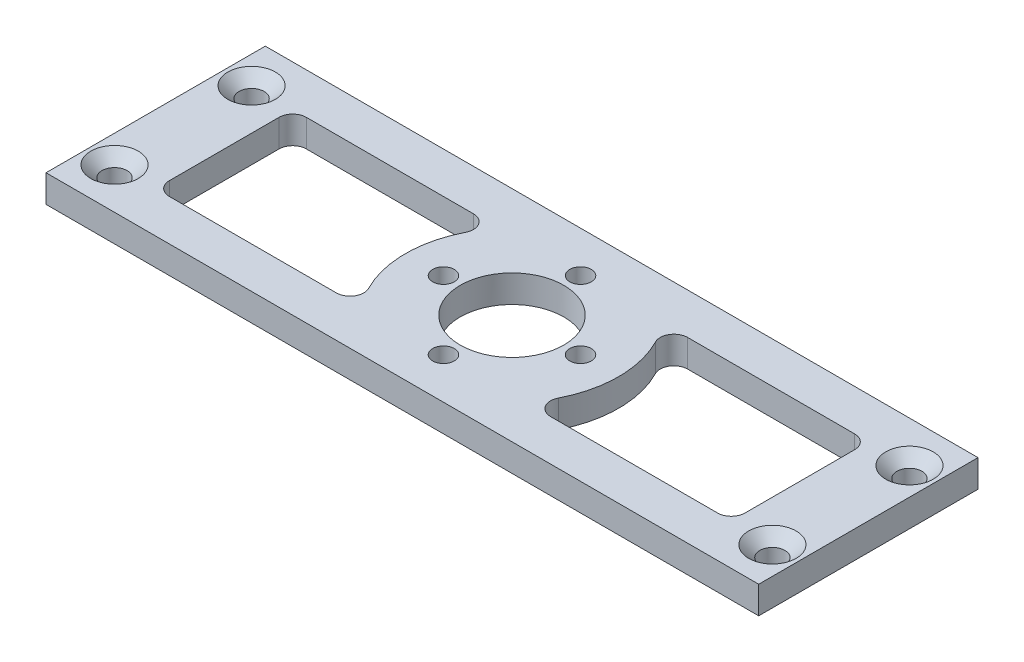
from build123d import *

# Parameters (mm, degrees)
SKETCH1_W                                         = 82.55
SKETCH1_H                                         = 25.4
BOSS_EXTRUDE1_DEPTH                               = 1.5875
F_12_0MM_DOWEL_HOLE1_D                            = 12
M3X0_5_TAPPED_HOLE1_D                             = 2.5
CSK_FOR_M2_5_FLAT_HEAD_MACHINE_SCREW1_D           = 2.9
CSK_FOR_M2_5_FLAT_HEAD_MACHINE_SCREW1_CSINK_D     = 5.5
CSK_FOR_M2_5_FLAT_HEAD_MACHINE_SCREW1_CSINK_ANGLE = 90
CUT_EXTRUDE1_DEPTH                                = 44.301226888
FILLET1_R                                         = 1.5875


with BuildPart() as part:
    # Sketch1 → Boss-Extrude1 (new, symmetric)
    with BuildSketch(Plane(origin=(0, 0, 0), x_dir=(1, 0, 0), z_dir=(0, 1, 0))):
        Rectangle(SKETCH1_W, SKETCH1_H)
    extrude(amount=BOSS_EXTRUDE1_DEPTH, both=True)

    # Ø12.0mm Dowel Hole1 (through all)
    with Locations(Plane(origin=(0, 1.5875, 0), x_dir=(1, 0, 0), z_dir=(0, 1, 0))):
        with Locations((0, 0)):
            Hole(F_12_0MM_DOWEL_HOLE1_D / 2)

    # M3x0.5 Tapped Hole1 (through all)
    with Locations(Plane(origin=(0, 1.5875, 0), x_dir=(1, 0, 0), z_dir=(0, 1, 0))):
        with Locations((0, 7.9375), (-7.9375, 0), (7.9375, 0), (0, -7.9375)):
            Hole(M3X0_5_TAPPED_HOLE1_D / 2)

    # CSK for M2.5 Flat Head Machine Screw1 (through all)
    with Locations(Plane(origin=(0, 1.5875, 0), x_dir=(1, 0, 0), z_dir=(0, 1, 0))):
        with Locations((-38.1, 7.9375), (-38.1, -7.9375)):
            csk_for_m2_5_flat_head_machine_screw1 = CounterSinkHole(CSK_FOR_M2_5_FLAT_HEAD_MACHINE_SCREW1_D / 2, CSK_FOR_M2_5_FLAT_HEAD_MACHINE_SCREW1_CSINK_D / 2, counter_sink_angle=CSK_FOR_M2_5_FLAT_HEAD_MACHINE_SCREW1_CSINK_ANGLE)

    # Mirror1: CSK for M2.5 Flat Head Machine Screw1 across plane
    add(csk_for_m2_5_flat_head_machine_screw1.mirror(Plane(origin=(0, 0, 0), x_dir=(0, 0, 1), z_dir=(1, 0, 0))), mode=Mode.SUBTRACT)

    # Sketch14 → Cut-Extrude1 (cut, through all)
    with BuildSketch(Plane(origin=(0, 1.5875, 0), x_dir=(1, 0, 0), z_dir=(0, 1, 0))):
        with BuildLine():
            Line((-33.3375, 7.9375), (-33.3375, -7.9375))
            Line((-33.3375, -7.9375), (-9.461426623, -7.9375))
            ThreePointArc((-9.461426623, -7.9375), (-12.35, 0), (-9.461426623, 7.9375))
            Line((-9.461426623, 7.9375), (-33.3375, 7.9375))
        make_face()
    cut_extrude1 = extrude(amount=-CUT_EXTRUDE1_DEPTH, mode=Mode.SUBTRACT)

    # Mirror2: Cut-Extrude1 across plane
    add(cut_extrude1.mirror(Plane(origin=(0, 0, 0), x_dir=(0, 0, 1), z_dir=(1, 0, 0))), mode=Mode.SUBTRACT)

    # Fillet1
    fillet1_edges = [part.edges().sort_by_distance(p)[0] for p in [
        (-33.3375, 0, -7.9375),
        (-9.461426623, 0, -7.9375),
        (-9.461426623, 0, 7.9375),
        (-33.3375, 0, 7.9375),
        (9.461426623, 0, -7.9375),
        (33.3375, 0, -7.9375),
        (33.3375, 0, 7.9375),
        (9.461426623, 0, 7.9375),
    ]]
    fillet(fillet1_edges, radius=FILLET1_R)


solid = part.part
